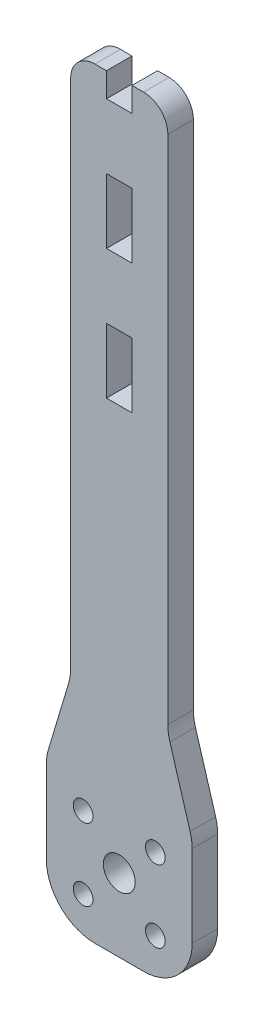
from build123d import *

# Parameters (mm, degrees)
SKETCH1_R           = 2.5
SKETCH1_R_2         = 1.55
SKETCH1_W           = 4
SKETCH1_H           = 10.16
BOSS_EXTRUDE1_DEPTH = 4


with BuildPart() as part:
    # Sketch1 → Boss-Extrude1 (new body)
    with BuildSketch(Plane.XY):
        with BuildLine():
            Line((0, 10.16), (4, 10.16))
            Line((4, 10.16), (4, 13.97))
            Line((4, 13.97), (5.81, 13.97))
            ThreePointArc((5.81, 13.97), (8.504076836, 12.854076836), (9.62, 10.16))
            Line((9.62, 10.16), (9.62, -70.001621467))
            ThreePointArc((9.62, -70.001621467), (9.700768986, -71.10814563), (9.941363707, -72.191212355))
            Line((9.941363707, -72.191212355), (13.108636293, -82.748787645))
            ThreePointArc((13.108636293, -82.748787645), (13.349231014, -83.83185437), (13.43, -84.938378533))
            Line((13.43, -84.938378533), (13.43, -97.79))
            ThreePointArc((13.43, -97.79), (11.198153673, -103.178153673), (5.81, -105.41))
            Line((5.81, -105.41), (-1.81, -105.41))
            ThreePointArc((-1.81, -105.41), (-7.198153673, -103.178153673), (-9.43, -97.79))
            Line((-9.43, -97.79), (-9.43, -84.938378533))
            ThreePointArc((-9.43, -84.938378533), (-9.349231014, -83.83185437), (-9.108636293, -82.748787645))
            Line((-9.108636293, -82.748787645), (-5.941363707, -72.191212355))
            ThreePointArc((-5.941363707, -72.191212355), (-5.700768986, -71.10814563), (-5.62, -70.001621467))
            Line((-5.62, -70.001621467), (-5.62, 10.16))
            ThreePointArc((-5.62, 10.16), (-4.504076836, 12.854076836), (-1.81, 13.97))
            Line((-1.81, 13.97), (0, 13.97))
            Line((0, 13.97), (0, 10.16))
        make_face()
        with Locations((2, -93.98)):
            Circle(SKETCH1_R, mode=Mode.SUBTRACT)
        with Locations((7.656854249, -88.323145751)):
            Circle(SKETCH1_R_2, mode=Mode.SUBTRACT)
        with Locations((-3.656854249, -88.323145751)):
            Circle(SKETCH1_R_2, mode=Mode.SUBTRACT)
        with Locations((-3.656854249, -99.636854249)):
            Circle(SKETCH1_R_2, mode=Mode.SUBTRACT)
        with Locations((7.656854249, -99.636854249)):
            Circle(SKETCH1_R_2, mode=Mode.SUBTRACT)
        with Locations((2, -5.08)):
            Rectangle(SKETCH1_W, SKETCH1_H, mode=Mode.SUBTRACT)
        with Locations((2, -25.4)):
            Rectangle(SKETCH1_W, SKETCH1_H, mode=Mode.SUBTRACT)
    extrude(amount=BOSS_EXTRUDE1_DEPTH)


solid = part.part
